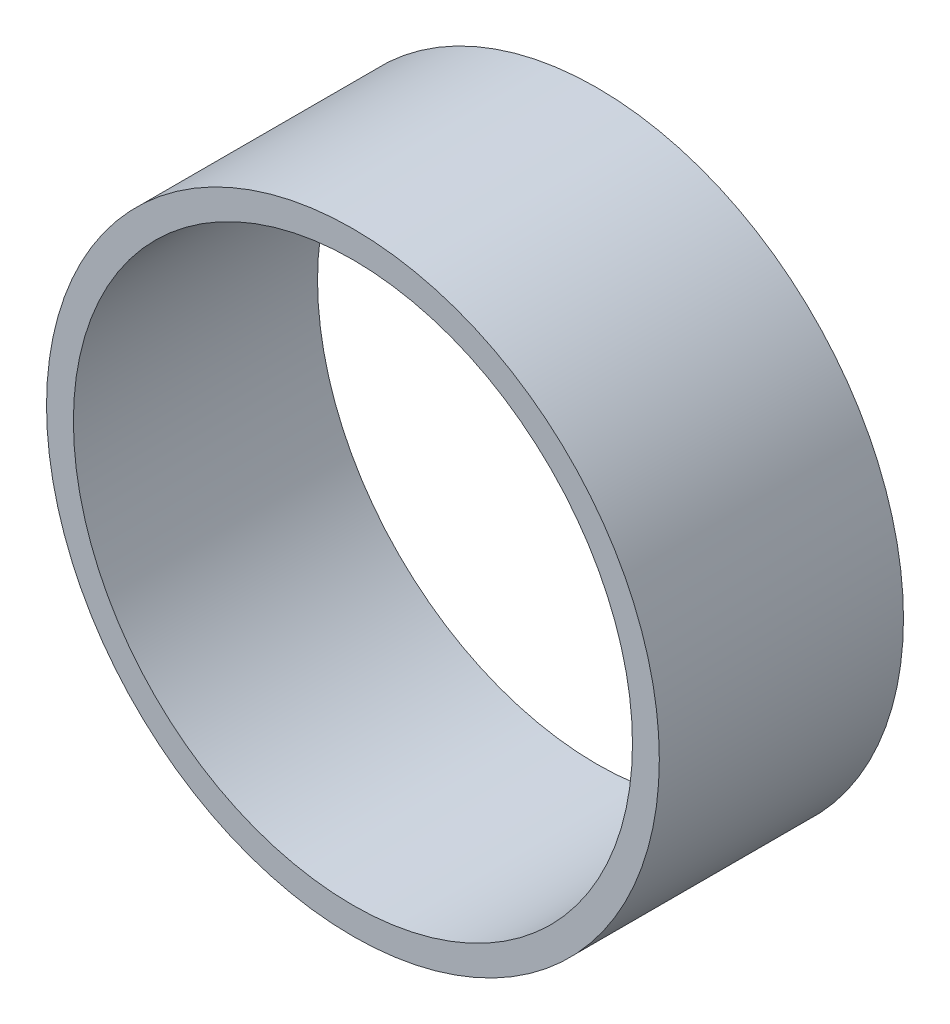
from build123d import *

# Parameters (mm, degrees)
SKETCH1_R           = 15.9385
SKETCH1_R_2         = 14.5415
BOSS_EXTRUDE1_DEPTH = 6.35


with BuildPart() as part:
    # Sketch1 → Boss-Extrude1 (new, symmetric)
    with BuildSketch(Plane.XY):
        Circle(SKETCH1_R)
        Circle(SKETCH1_R_2, mode=Mode.SUBTRACT)
    extrude(amount=BOSS_EXTRUDE1_DEPTH, both=True)


solid = part.part
